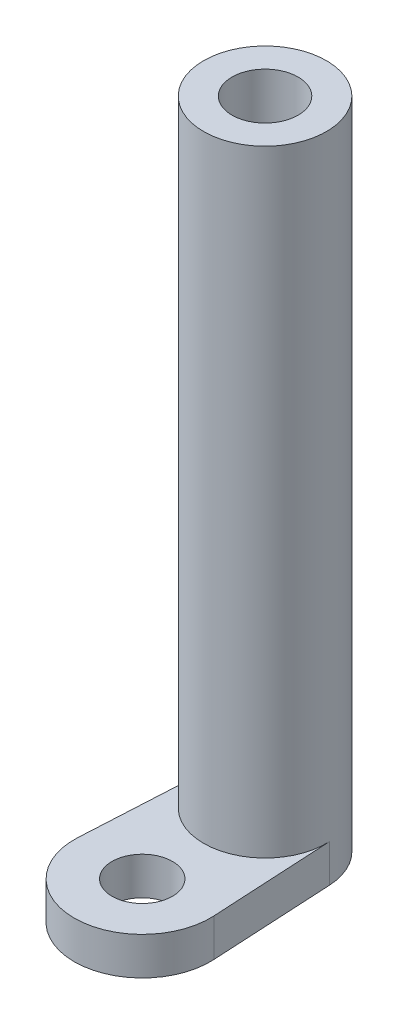
from build123d import *

# Parameters (mm, degrees)
SKETCH1_R           = 3.25
SKETCH1_R_2         = 1.75
BOSS_EXTRUDE1_DEPTH = 34.625
SKETCH2_R           = 1.75
SKETCH2_R_2         = 1.6
BOSS_EXTRUDE2_DEPTH = 2


with BuildPart() as part:
    # Sketch1 → Boss-Extrude1 (new body)
    with BuildSketch(Plane(origin=(0, 0, 0), x_dir=(1, 0, 0), z_dir=(0, 1, 0))):
        with Locations(Location((0, 0, 0), (0, 0, 180))):
            Circle(SKETCH1_R)
        with Locations(Location((0, 0, 0), (0, 0, 180))):
            Circle(SKETCH1_R_2, mode=Mode.SUBTRACT)
    extrude(amount=BOSS_EXTRUDE1_DEPTH)

    # Sketch2 → Boss-Extrude2 (add)
    with BuildSketch(Plane(origin=(0, 0, 0), x_dir=(1, 0, 0), z_dir=(0, 1, 0))):
        with BuildLine():
            Line((-3.594777277, -6.306153846), (-3.245285041, 0.175))
            ThreePointArc((-3.245285041, 0.175), (0, 3.25), (3.245285041, 0.175))
            Line((3.245285041, 0.175), (3.594777277, -6.306153846))
            ThreePointArc((3.594777277, -6.306153846), (0, -10.1), (-3.594777277, -6.306153846))
        make_face()
        with Locations(Location((0, 0, 0), (0, 0, 180))):
            Circle(SKETCH2_R, mode=Mode.SUBTRACT)
        with Locations(Location((0, -6.5, 0), (0, 0, 270))):
            Circle(SKETCH2_R_2, mode=Mode.SUBTRACT)
    extrude(amount=BOSS_EXTRUDE2_DEPTH)


solid = part.part
